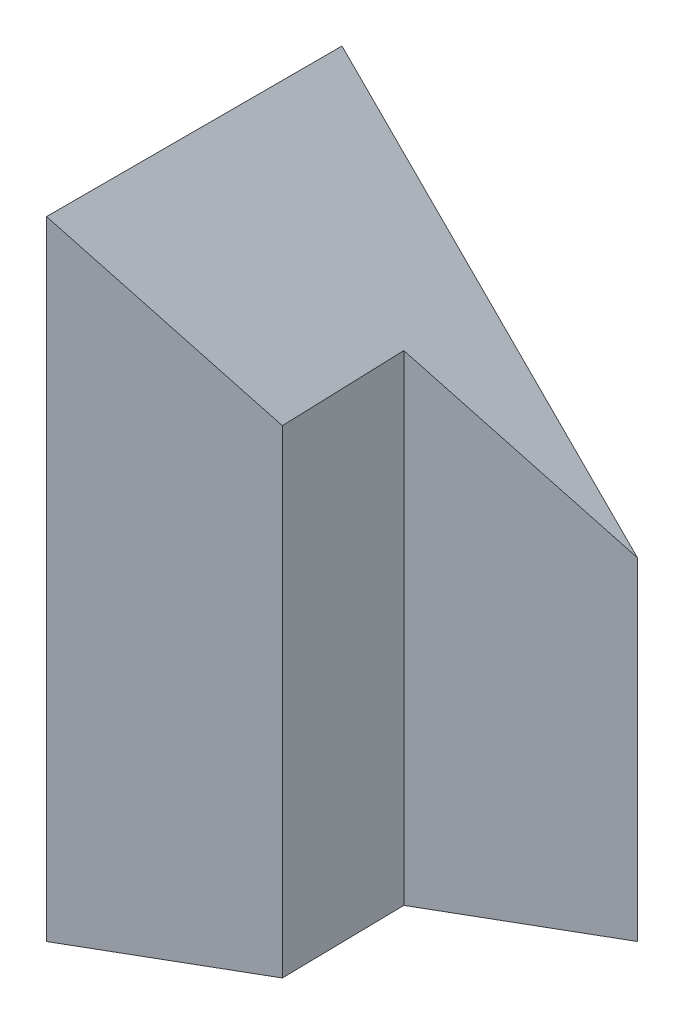
from build123d import *

# Parameters (mm, degrees)
BOSS_EXTRUDE1_DEPTH     = 107.95
CUT_EXTRUDE1_DEPTH      = 116.548362966
CUT_EXTRUDE1_DEPTH_BACK = 116.548362966


with BuildPart() as part:
    # Sketch1 → Boss-Extrude1 (new body)
    with BuildSketch(Plane(origin=(0, 0, 0), x_dir=(1, 0, 0), z_dir=(0, 1, 0))):
        Polygon((25.093975904, 18.590963855), (-25.706024096, 18.590963855), (-25.706024096, -32.209036145), (0.000274042, -17.367497994), (-0.370757644, 3.888893087), align=None)
    extrude(amount=BOSS_EXTRUDE1_DEPTH)

    # Sketch2 → Cut-Extrude1 (cut, two sides: drawn at the far end of the back side and taken through both)
    with BuildSketch(Plane.XY.offset(-CUT_EXTRUDE1_DEPTH_BACK)):
        Polygon((-201.500786154, 283.744762058), (-25.706024096, 107.95), (25.093975904, 57.15), (200.888737961, -118.644762058), (552.478262077, 232.944762058), (150.088737961, 635.334286173), align=None)
    extrude(amount=CUT_EXTRUDE1_DEPTH + CUT_EXTRUDE1_DEPTH_BACK, mode=Mode.SUBTRACT)


solid = part.part
